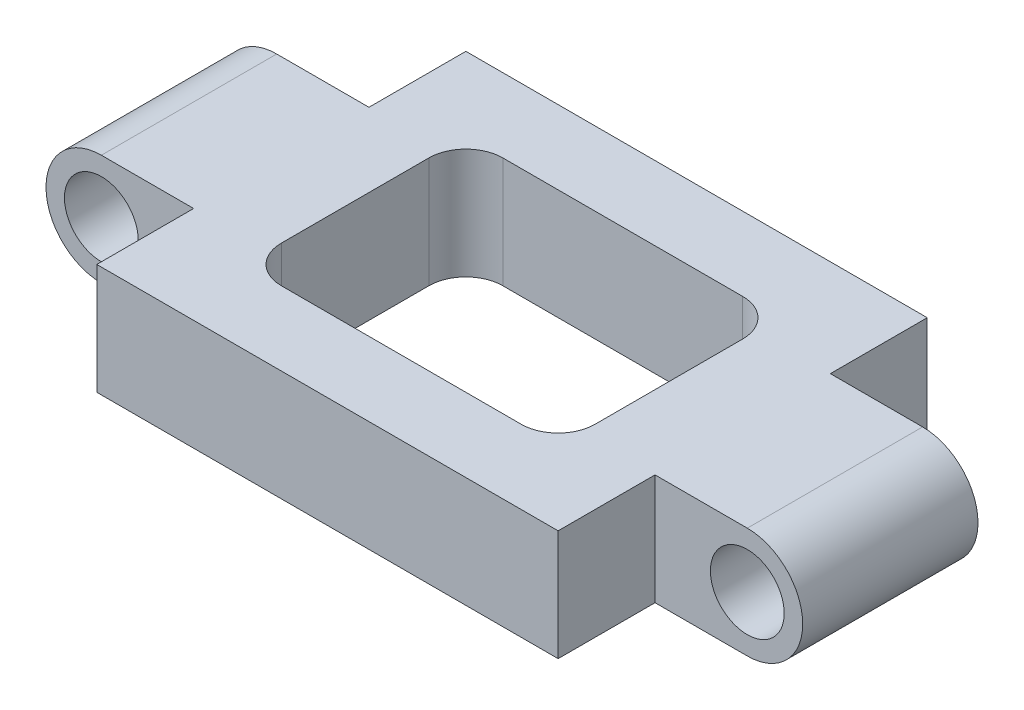
from build123d import *

# Parameters (mm, degrees)
SKETCH1_R           = 2
BOSS_EXTRUDE1_DEPTH = 10
CUT_EXTRUDE3_REACH  = 25.585
SKETCH2_W           = 8
SKETCH2_H           = 5.25
SKETCH3_W           = 17
SKETCH3_H           = 12
CUT_EXTRUDE4_DEPTH  = 10
FILLET1_R           = 2


with BuildPart() as part:
    # Sketch1 → Boss-Extrude1 (new, symmetric)
    with BuildSketch(Plane.XY):
        with BuildLine():
            Line((17.5, -3), (-17.5, -3))
            ThreePointArc((-17.5, -3), (-20.5, 0), (-17.5, 3))
            Line((-17.5, 3), (17.5, 3))
            ThreePointArc((17.5, 3), (20.5, 0), (17.5, -3))
        make_face()
        with Locations((17.5, 0)):
            Circle(SKETCH1_R, mode=Mode.SUBTRACT)
        with Locations((-17.5, 0)):
            Circle(SKETCH1_R, mode=Mode.SUBTRACT)
    extrude(amount=BOSS_EXTRUDE1_DEPTH, both=True)

    # Cut-Extrude3: up to this face of the body (flat: up to its plane)
    cut_extrude3_end = Plane(part.part.faces().sort_by_distance((0, -3, 0))[0])
    # Sketch2 → Cut-Extrude3 (cut, up to the picked face)
    with BuildSketch(Plane(origin=(0, 3, 0), x_dir=(1, 0, 0), z_dir=(0, 1, 0)), mode=Mode.PRIVATE) as cut_extrude3_sk1:
        with Locations((-16.5, -7.375)):
            Rectangle(SKETCH2_W, SKETCH2_H)
    cut_extrude3_tool1 = split(extrude(cut_extrude3_sk1.sketch, amount=-CUT_EXTRUDE3_REACH, mode=Mode.PRIVATE), bisect_by=cut_extrude3_end, keep=Keep.BOTH, mode=Mode.PRIVATE)
    # Sketch2 → Cut-Extrude3 (cut, up to the picked face)
    with BuildSketch(Plane(origin=(0, 3, 0), x_dir=(1, 0, 0), z_dir=(0, 1, 0)), mode=Mode.PRIVATE) as cut_extrude3_sk2:
        with Locations((-16.5, 7.375)):
            Rectangle(SKETCH2_W, SKETCH2_H)
    cut_extrude3_tool2 = split(extrude(cut_extrude3_sk2.sketch, amount=-CUT_EXTRUDE3_REACH, mode=Mode.PRIVATE), bisect_by=cut_extrude3_end, keep=Keep.BOTH, mode=Mode.PRIVATE)
    # Sketch2 → Cut-Extrude3 (cut, up to the picked face)
    with BuildSketch(Plane(origin=(0, 3, 0), x_dir=(1, 0, 0), z_dir=(0, 1, 0)), mode=Mode.PRIVATE) as cut_extrude3_sk3:
        with Locations((16.5, 7.375)):
            Rectangle(SKETCH2_W, SKETCH2_H)
    cut_extrude3_tool3 = split(extrude(cut_extrude3_sk3.sketch, amount=-CUT_EXTRUDE3_REACH, mode=Mode.PRIVATE), bisect_by=cut_extrude3_end, keep=Keep.BOTH, mode=Mode.PRIVATE)
    # Sketch2 → Cut-Extrude3 (cut, up to the picked face)
    with BuildSketch(Plane(origin=(0, 3, 0), x_dir=(1, 0, 0), z_dir=(0, 1, 0)), mode=Mode.PRIVATE) as cut_extrude3_sk4:
        with Locations((16.5, -7.375)):
            Rectangle(SKETCH2_W, SKETCH2_H)
    cut_extrude3_tool4 = split(extrude(cut_extrude3_sk4.sketch, amount=-CUT_EXTRUDE3_REACH, mode=Mode.PRIVATE), bisect_by=cut_extrude3_end, keep=Keep.BOTH, mode=Mode.PRIVATE)
    add(cut_extrude3_tool1.solids().sort_by(Axis((-16.5, 3, 7.375), (0, -1, 0)))[0], mode=Mode.SUBTRACT)
    add(cut_extrude3_tool2.solids().sort_by(Axis((-16.5, 3, -7.375), (0, -1, 0)))[0], mode=Mode.SUBTRACT)
    add(cut_extrude3_tool3.solids().sort_by(Axis((16.5, 3, -7.375), (0, -1, 0)))[0], mode=Mode.SUBTRACT)
    add(cut_extrude3_tool4.solids().sort_by(Axis((16.5, 3, 7.375), (0, -1, 0)))[0], mode=Mode.SUBTRACT)

    # Sketch3 → Cut-Extrude4 (cut)
    with BuildSketch(Plane(origin=(0, 3, 0), x_dir=(1, 0, 0), z_dir=(0, 1, 0))):
        Rectangle(SKETCH3_W, SKETCH3_H)
    extrude(amount=-CUT_EXTRUDE4_DEPTH, mode=Mode.SUBTRACT)

    # Fillet1
    fillet1_edges = [part.edges().sort_by_distance(p)[0] for p in [
        (-8.5, 0, 6),
        (-8.5, 0, -6),
        (8.5, 0, -6),
        (8.5, 0, 6),
    ]]
    fillet(fillet1_edges, radius=FILLET1_R)


solid = part.part
